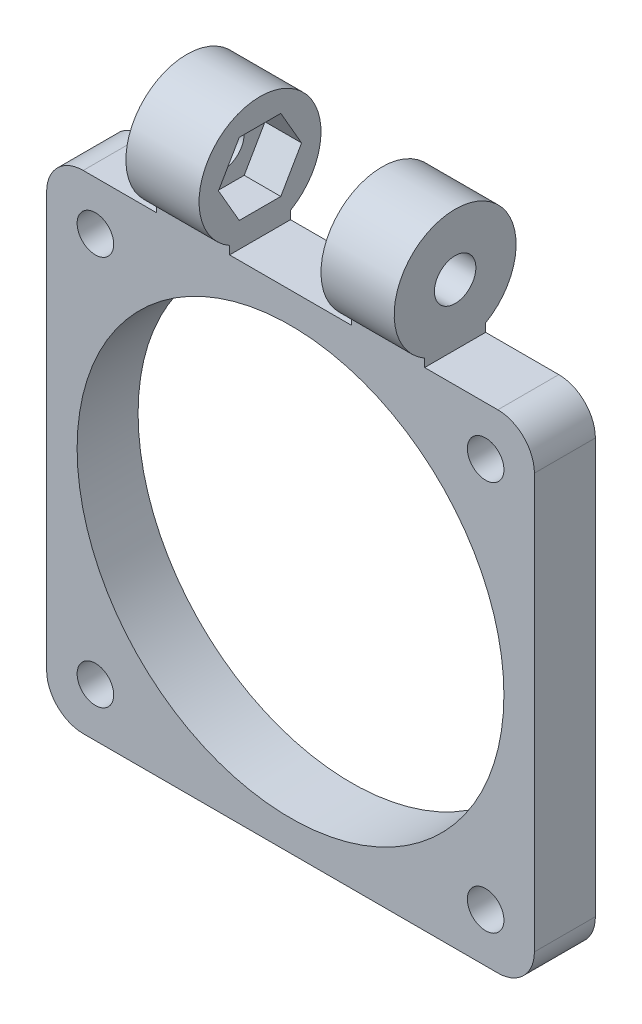
from build123d import *

# Parameters (mm, degrees)
SKETCH_1_W                = 40
SKETCH_1_H                = 40
EXTRUDE_1_DEPTH           = 5
SKETCH_2_R                = 1.5
SKETCH_2_R_2              = 16
CUT_EXTRUDE_1_DEPTH       = 29.722813233
SKETCH_3_W                = 6
SKETCH_3_H                = 5
EXTRUDE_2_DEPTH           = 10
SKETCH_4_R                = 3
EXTRUDE_3_DEPTH           = 6
EXTRUDE_START             = -6
SKETCH_5_R                = 3
EXTRUDE_4_DEPTH           = 6
CUT_EXTRUDE_2_DEPTH       = 44.488504228
SKETCH_7_R                = 1.5
CUT_EXTRUDE_3_DEPTH       = 43.133715716
SKETCH_9_R                = 4
EXTRUDE_5_DEPTH           = 6
SKETCH_10_R               = 4
EXTRUDE_6_DEPTH           = 6
SKETCH_11_R               = 1.5
CUT_EXTRUDE_4_DEPTH       = 43.944731924
CUT_EXTRUDE_5_DEPTH       = 13
CUT_EXTRUDE_5_DEPTH_BACK  = 3
FILLET_1_R                = 3
CUT_EXTRUDE_6_DEPTH       = 3
CUT_EXTRUDE_7_DEPTH       = 3
SKETCH_15_R               = 1.65
CUT_EXTRUDE_8_DEPTH       = 43.944731924
SKETCH_16_R               = 5
EXTRUDE_7_DEPTH           = 6
SKETCH_17_R               = 5
EXTRUDE_8_DEPTH           = 6
SKETCH_18_R               = 1.7
CUT_EXTRUDE_9_DEPTH       = 44.786413418
CUT_EXTRUDE_10_DEPTH      = 13
CUT_EXTRUDE_10_DEPTH_BACK = 3
SKETCH_20_R               = 17.5
CUT_EXTRUDE_11_DEPTH      = 37.827299657


with BuildPart() as part:
    # Эскиз1 → Бобышка-Вытянуть1 (new body)
    with BuildSketch(Plane.XY):
        Rectangle(SKETCH_1_W, SKETCH_1_H)
    extrude(amount=EXTRUDE_1_DEPTH)

    # Эскиз2 → Вырез-Вытянуть1 (cut, through all)
    with BuildSketch(Plane.XY.offset(5)):
        with Locations((-16, 16)):
            Circle(SKETCH_2_R)
        Circle(SKETCH_2_R_2)
        with Locations((16, 16)):
            Circle(SKETCH_2_R)
        with Locations((16, -16)):
            Circle(SKETCH_2_R)
        with Locations((-16, -16)):
            Circle(SKETCH_2_R)
    extrude(amount=-CUT_EXTRUDE_1_DEPTH, mode=Mode.SUBTRACT)

    # Эскиз3 → Бобышка-Вытянуть2 (add)
    with BuildSketch(Plane(origin=(0, 20, 0), x_dir=(1, 0, 0), z_dir=(0, 1, 0))):
        with Locations((-8, -2.5)):
            Rectangle(SKETCH_3_W, SKETCH_3_H)
        with Locations((8, -2.5)):
            Rectangle(SKETCH_3_W, SKETCH_3_H)
    extrude(amount=EXTRUDE_2_DEPTH)

    # Эскиз4 → Бобышка-Вытянуть3 (add)
    with BuildSketch(Plane.ZY.offset(11)):
        with Locations((2.5, 25)):
            Circle(SKETCH_4_R)
    extrude(amount=-EXTRUDE_3_DEPTH)

    # Эскиз5 → Бобышка-Вытянуть4 (add)
    with BuildSketch(Plane(origin=(11, 0, 0), x_dir=(0, 0, -1), z_dir=(1, 0, 0)).offset(EXTRUDE_START)):
        with Locations((-2.5, 25)):
            Circle(SKETCH_5_R)
    extrude(amount=EXTRUDE_4_DEPTH)

    # Эскиз6 → Вырез-Вытянуть2 (cut, through all)
    with BuildSketch(Plane(origin=(11, 0, 0), x_dir=(0, 0, -1), z_dir=(1, 0, 0))):
        with BuildLine():
            Line((0, 30), (-5, 30))
            Line((-5, 30), (-5, 26.658312395))
            ThreePointArc((-5, 26.658312395), (-2.5, 28), (0, 26.658312395))
            Line((0, 26.658312395), (0, 30))
        make_face()
    extrude(amount=-CUT_EXTRUDE_2_DEPTH, mode=Mode.SUBTRACT)

    # Эскиз7 → Вырез-Вытянуть3 (cut, through all)
    with BuildSketch(Plane.ZY.offset(11)):
        with Locations((2.5, 25)):
            Circle(SKETCH_7_R)
    extrude(amount=-CUT_EXTRUDE_3_DEPTH, mode=Mode.SUBTRACT)

    # Эскиз9 → Бобышка-Вытянуть5 (add)
    with BuildSketch(Plane.ZY.offset(11)):
        with Locations((2.5, 25)):
            Circle(SKETCH_9_R)
    extrude(amount=-EXTRUDE_5_DEPTH)

    # Эскиз10 → Бобышка-Вытянуть6 (add)
    with BuildSketch(Plane(origin=(11, 0, 0), x_dir=(0, 0, -1), z_dir=(1, 0, 0)).offset(EXTRUDE_START)):
        with Locations((-2.5, 25)):
            Circle(SKETCH_10_R)
    extrude(amount=EXTRUDE_6_DEPTH)

    # Эскиз11 → Вырез-Вытянуть4 (cut, through all)
    with BuildSketch(Plane(origin=(11, 0, 0), x_dir=(0, 0, -1), z_dir=(1, 0, 0))):
        with Locations((-2.5, 25)):
            Circle(SKETCH_11_R)
    extrude(amount=-CUT_EXTRUDE_4_DEPTH, mode=Mode.SUBTRACT)

    # Эскиз12 → Вырез-Вытянуть5 (cut, two sides: drawn at the far end of the back side and taken through both)
    with BuildSketch(Plane(origin=(-5, 0, 0), x_dir=(0, 0, -1), z_dir=(1, 0, 0)).offset(-CUT_EXTRUDE_5_DEPTH_BACK)):
        Polygon((-0.91228676, 22.25), (0.675426481, 25), (-0.91228676, 27.75), (-4.08771324, 27.75), (-5.675426481, 25), (-4.08771324, 22.25), align=None)
    extrude(amount=CUT_EXTRUDE_5_DEPTH + CUT_EXTRUDE_5_DEPTH_BACK, mode=Mode.SUBTRACT)

    # Скругление1
    fillet_1_edges = [part.edges().sort_by_distance(p)[0] for p in [
        (20, -20, 2.5),
        (-20, -20, 2.5),
        (-20, 20, 2.5),
        (20, 20, 2.5),
    ]]
    fillet(fillet_1_edges, radius=FILLET_1_R)

    # Эскиз13 → Вырез-Вытянуть6 (cut)
    with BuildSketch(Plane(origin=(-5, 0, 0), x_dir=(0, 0, -1), z_dir=(1, 0, 0))):
        Polygon((-4.174315781, 22.1), (-0.825684219, 22.1), (0.848631561, 25), (-0.825684219, 27.9), (-4.174315781, 27.9), (-5.848631561, 25), align=None)
    extrude(amount=-CUT_EXTRUDE_6_DEPTH, mode=Mode.SUBTRACT)

    # Эскиз14 → Вырез-Вытянуть7 (cut)
    with BuildSketch(Plane.ZY.offset(-5)):
        Polygon((4.174315781, 22.1), (5.848631561, 25), (4.174315781, 27.9), (0.825684219, 27.9), (-0.848631561, 25), (0.825684219, 22.1), align=None)
    extrude(amount=-CUT_EXTRUDE_7_DEPTH, mode=Mode.SUBTRACT)

    # Эскиз15 → Вырез-Вытянуть8 (cut, through all)
    with BuildSketch(Plane.ZY.offset(11)):
        with Locations(Location((2.5, 25, 0), (0, 0, 180))):
            Circle(SKETCH_15_R)
    extrude(amount=-CUT_EXTRUDE_8_DEPTH, mode=Mode.SUBTRACT)

    # Эскиз16 → Бобышка-Вытянуть7 (add)
    with BuildSketch(Plane.ZY.offset(11)):
        with Locations((2.5, 25)):
            Circle(SKETCH_16_R)
    extrude(amount=-EXTRUDE_7_DEPTH)

    # Эскиз17 → Бобышка-Вытянуть8 (add)
    with BuildSketch(Plane(origin=(11, 0, 0), x_dir=(0, 0, -1), z_dir=(1, 0, 0)).offset(EXTRUDE_START)):
        with Locations((-2.5, 25)):
            Circle(SKETCH_17_R)
    extrude(amount=EXTRUDE_8_DEPTH)

    # Эскиз18 → Вырез-Вытянуть9 (cut, through all)
    with BuildSketch(Plane(origin=(11, 0, 0), x_dir=(0, 0, -1), z_dir=(1, 0, 0))):
        with Locations((-2.5, 25)):
            Circle(SKETCH_18_R)
    extrude(amount=-CUT_EXTRUDE_9_DEPTH, mode=Mode.SUBTRACT)

    # Эскиз19 → Вырез-Вытянуть10 (cut, two sides: drawn at the far end of the back side and taken through both)
    with BuildSketch(Plane(origin=(-5, 0, 0), x_dir=(0, 0, -1), z_dir=(1, 0, 0)).offset(-CUT_EXTRUDE_10_DEPTH_BACK)):
        Polygon((-4.203183294, 22.05), (-0.796816706, 22.05), (0.906366588, 25), (-0.796816706, 27.95), (-4.203183294, 27.95), (-5.906366588, 25), align=None)
    extrude(amount=CUT_EXTRUDE_10_DEPTH + CUT_EXTRUDE_10_DEPTH_BACK, mode=Mode.SUBTRACT)

    # Эскиз20 → Вырез-Вытянуть11 (cut, through all)
    with BuildSketch(Plane.XY.offset(5)):
        Circle(SKETCH_20_R)
    extrude(amount=-CUT_EXTRUDE_11_DEPTH, mode=Mode.SUBTRACT)


solid = part.part
